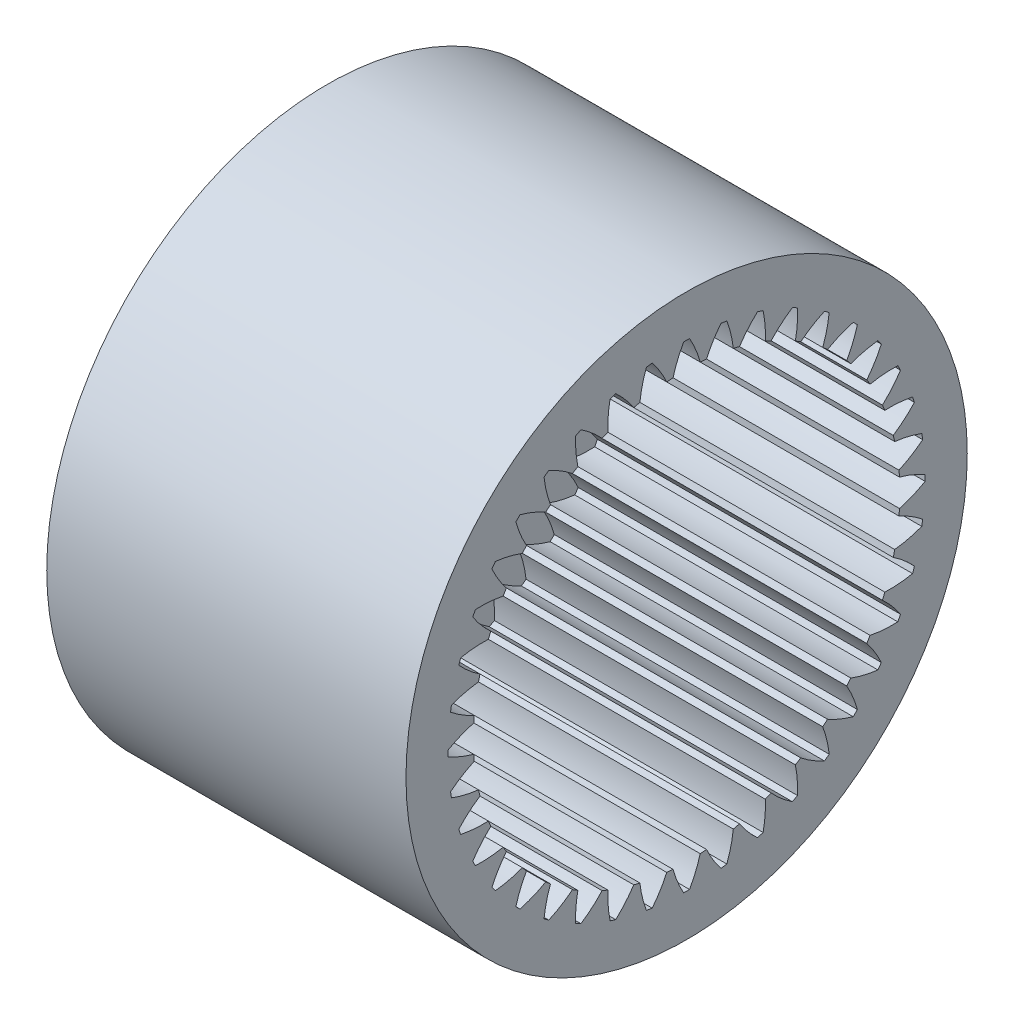
from build123d import *

# Parameters (mm, degrees)
BASPROSKE_W         = 54
BASPROSKE_H         = 12
TOOTHCUT_DEPTH      = 89.971905678
TEETHCUTS_COUNT     = 40
TEETHCUTS_ANGLE     = 351
SKETCH2_R           = 50
SKETCH2_R_2         = 11
BOSS_EXTRUDE2_DEPTH = 10


with BuildPart() as part:
    # BasProSke → Base-Revolve (revolve)
    with BuildSketch(Plane(origin=(0, 0, 0), x_dir=(1, 0, 0), z_dir=(0, 1, 0)), mode=Mode.PRIVATE) as base_revolve_sk:
        with Locations((27, 44)):
            Rectangle(BASPROSKE_W, BASPROSKE_H)
    revolve(base_revolve_sk.sketch.rotate(Axis((-10, 0, 0), (1, 0, 0)), 180), axis=Axis((-10, 0, 0), (1, 0, 0)))

    # TooCutSke → ToothCut (cut, through all)
    with BuildSketch(Plane(origin=(0, 0, 0), x_dir=(0, 0, -1), z_dir=(1, 0, 0))):
        with BuildLine():
            ThreePointArc((2.427265626, 37.896947459), (1.618641911, 40.256878641), (0.522524415, 42.497787816))
            ThreePointArc((0.522524415, 42.497787816), (0, 42.501), (-0.522524415, 42.497787816))
            ThreePointArc((-0.522524415, 42.497787816), (-1.618641911, 40.256878641), (-2.427265626, 37.896947459))
            ThreePointArc((-2.427265626, 37.896947459), (0, 37.9746), (2.427265626, 37.896947459))
        make_face()
    toothcut = extrude(amount=TOOTHCUT_DEPTH, mode=Mode.SUBTRACT)

    # TeethCuts: ToothCut ×40 about axis
    teethcuts_axis = Axis((-10, 0, 0), (1, 0, 0))
    for i in range(1, TEETHCUTS_COUNT):
        add(toothcut.rotate(teethcuts_axis, i * TEETHCUTS_ANGLE / (TEETHCUTS_COUNT - 1)), mode=Mode.SUBTRACT)

    # Sketch2 → Boss-Extrude2 (add)
    with BuildSketch(Plane.ZY):
        Circle(SKETCH2_R)
        Circle(SKETCH2_R_2, mode=Mode.SUBTRACT)
    extrude(amount=BOSS_EXTRUDE2_DEPTH)


solid = part.part
